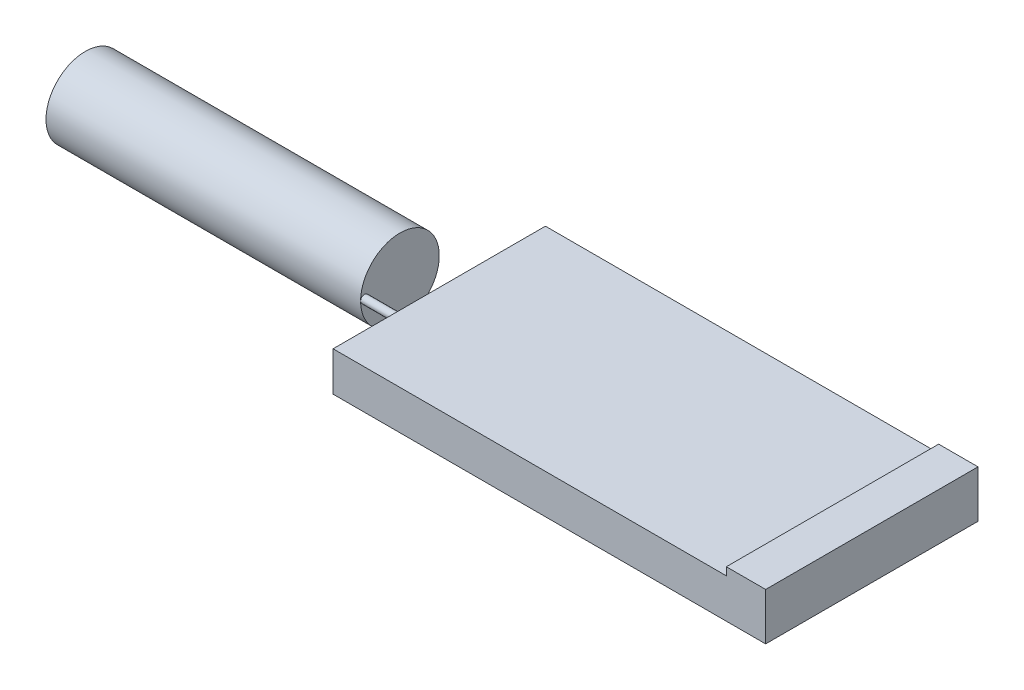
from build123d import *

# Parameters (mm, degrees)
SKETCH_1_W      = 27.5
SKETCH_1_H      = 13.5
EXTRUDE_1_DEPTH = 2.5
SKETCH_2_W      = 2.5
SKETCH_2_H      = 13.5
EXTRUDE_2_DEPTH = 3
SKETCH_3_R      = 0.25
EXTRUDE_3_DEPTH = 3
SKETCH_4_R      = 0.25
SKETCH_4_R_2    = 2.5
EXTRUDE_5_DEPTH = 20


with BuildPart() as part:
    # Эскиз1 → Бобышка-Вытянуть1 (new body)
    with BuildSketch(Plane(origin=(0, 0, 0), x_dir=(1, 0, 0), z_dir=(0, 1, 0))):
        Rectangle(SKETCH_1_W, SKETCH_1_H)
    extrude(amount=EXTRUDE_1_DEPTH)

    # Эскиз2 → Бобышка-Вытянуть2 (add)
    with BuildSketch(Plane.XZ):
        with Locations((12.5, 0)):
            Rectangle(SKETCH_2_W, SKETCH_2_H)
    extrude(amount=-EXTRUDE_2_DEPTH)

    # Эскиз3 → Бобышка-Вытянуть3 (add)
    with BuildSketch(Plane.ZY.offset(13.75)):
        with Locations(Location((1.75, 1.25, 0), (0, 0, 180))):
            Circle(SKETCH_3_R)
    extrude(amount=EXTRUDE_3_DEPTH)

    # Эскиз4 → Бобышка-Вытянуть5 (add)
    with BuildSketch(Plane.ZY.offset(16.75)):
        with Locations(Location((1.75, 1.25, 0), (0, 0, 180))):
            Circle(SKETCH_4_R)
        with Locations((-0.5, 1.25)):
            Circle(SKETCH_4_R_2)
        with Locations(Location((1.75, 1.25, 0), (0, 0, 180))):
            Circle(SKETCH_4_R)
    extrude(amount=EXTRUDE_5_DEPTH)


solid = part.part
